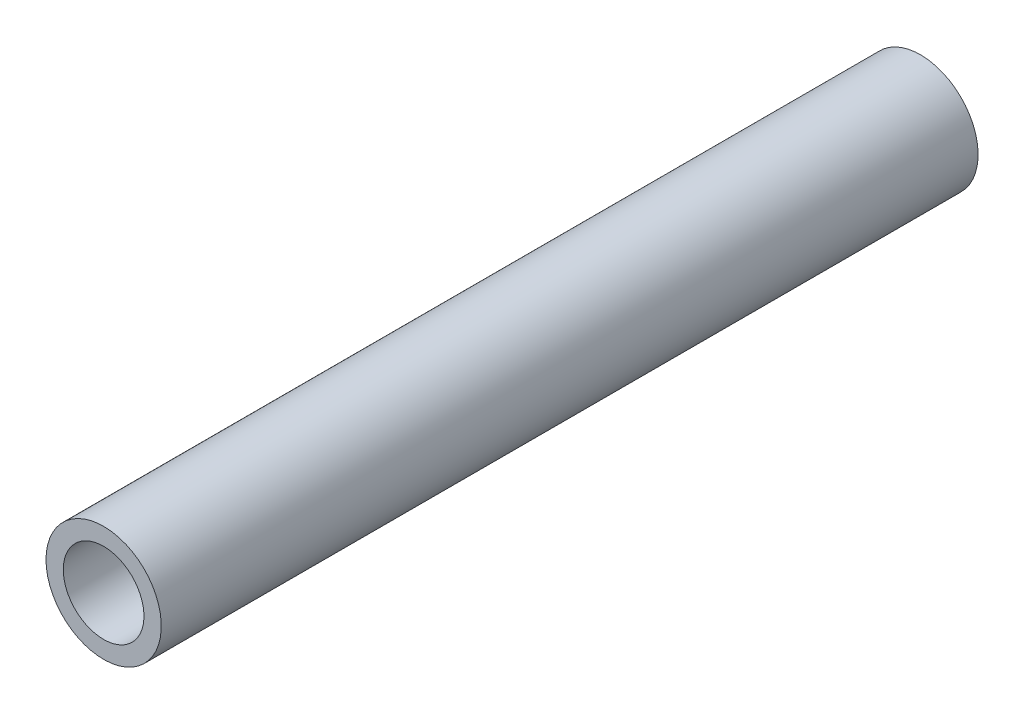
from build123d import *

# Parameters (mm, degrees)
SKETCH1_R           = 4
SKETCH1_R_2         = 2.8
BOSS_EXTRUDE1_DEPTH = 56.7


with BuildPart() as part:
    # Sketch1 → Boss-Extrude1 (new body)
    with BuildSketch(Plane.XY):
        with Locations(Location((0, 0, 0), (0, 0, 180))):
            Circle(SKETCH1_R)
        with Locations(Location((0, 0, 0), (0, 0, 180))):
            Circle(SKETCH1_R_2, mode=Mode.SUBTRACT)
    extrude(amount=BOSS_EXTRUDE1_DEPTH)


solid = part.part
